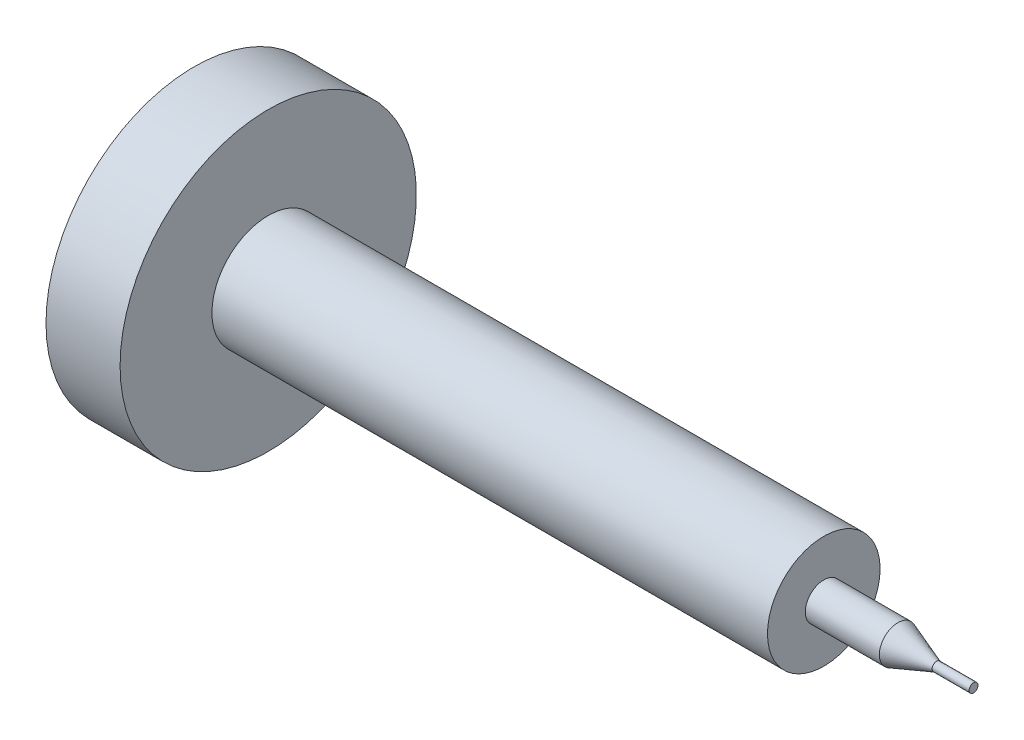
from build123d import *


with BuildPart() as part:
    # Sketch1 → Revolve1 (revolve)
    with BuildSketch(Plane.XY, mode=Mode.PRIVATE) as revolve1_sk:
        Polygon((0, 0), (0, 6.35), (3.175, 6.35), (3.175, 2.413), (26.9875, 2.413), (26.9875, 0.79375), (30.1625, 0.79375), (31.819915753, 0.1905), (33.407415753, 0.1905), (33.407415753, 0), align=None)
    revolve(revolve1_sk.sketch.rotate(Axis((0, 0, 0), (1, 0, 0)), 90), axis=Axis((0, 0, 0), (1, 0, 0)))


solid = part.part
